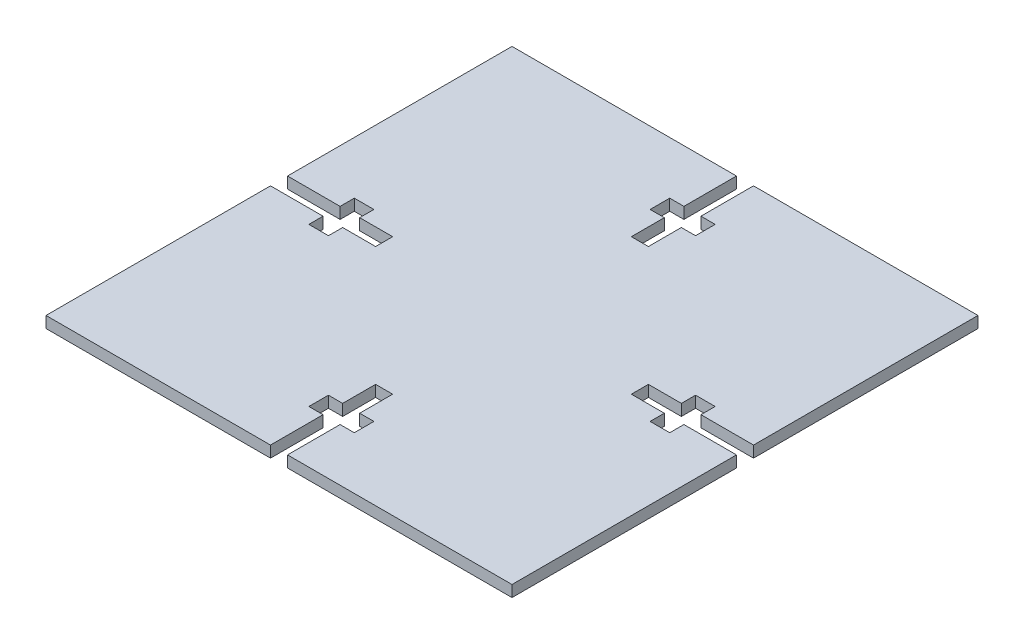
from build123d import *

# Parameters (mm, degrees)
SKETCH1_W           = 82
SKETCH1_H           = 82
BOSS_EXTRUDE1_DEPTH = 2
CUT_EXTRUDE2_DEPTH  = 10


with BuildPart() as part:
    # Sketch1 → Boss-Extrude1 (new body)
    with BuildSketch(Plane(origin=(0, 0, 0), x_dir=(1, 0, 0), z_dir=(0, 1, 0))):
        Rectangle(SKETCH1_W, SKETCH1_H)
    extrude(amount=BOSS_EXTRUDE1_DEPTH)

    # Sketch2 → Cut-Extrude2 (cut)
    with BuildSketch(Plane(origin=(0, 0, 0), x_dir=(-1, 0, 0), z_dir=(0, -1, 0))):
        Polygon((-1.5, 22.5), (1.5, 22.5), (1.5, 28.3), (4, 28.3), (4, 31.75), (1.5, 31.75), (1.5, 41), (-1.5, 41), (-1.5, 31.75), (-4, 31.75), (-4, 28.3), (-1.5, 28.3), align=None)
        Polygon((28.3, -4), (28.3, -1.5), (22.5, -1.5), (22.5, 1.5), (28.3, 1.5), (28.3, 4), (31.75, 4), (31.75, 1.5), (41, 1.5), (41, -1.5), (31.75, -1.5), (31.75, -4), align=None)
        Polygon((-4, -28.3), (-1.5, -28.3), (-1.5, -22.5), (1.5, -22.5), (1.5, -28.3), (4, -28.3), (4, -31.75), (1.5, -31.75), (1.5, -41), (-1.5, -41), (-1.5, -31.75), (-4, -31.75), align=None)
        Polygon((-28.3, 4), (-28.3, 1.5), (-22.5, 1.5), (-22.5, -1.5), (-28.3, -1.5), (-28.3, -4), (-31.75, -4), (-31.75, -1.5), (-41, -1.5), (-41, 1.5), (-31.75, 1.5), (-31.75, 4), align=None)
    extrude(amount=-CUT_EXTRUDE2_DEPTH, mode=Mode.SUBTRACT)


solid = part.part
